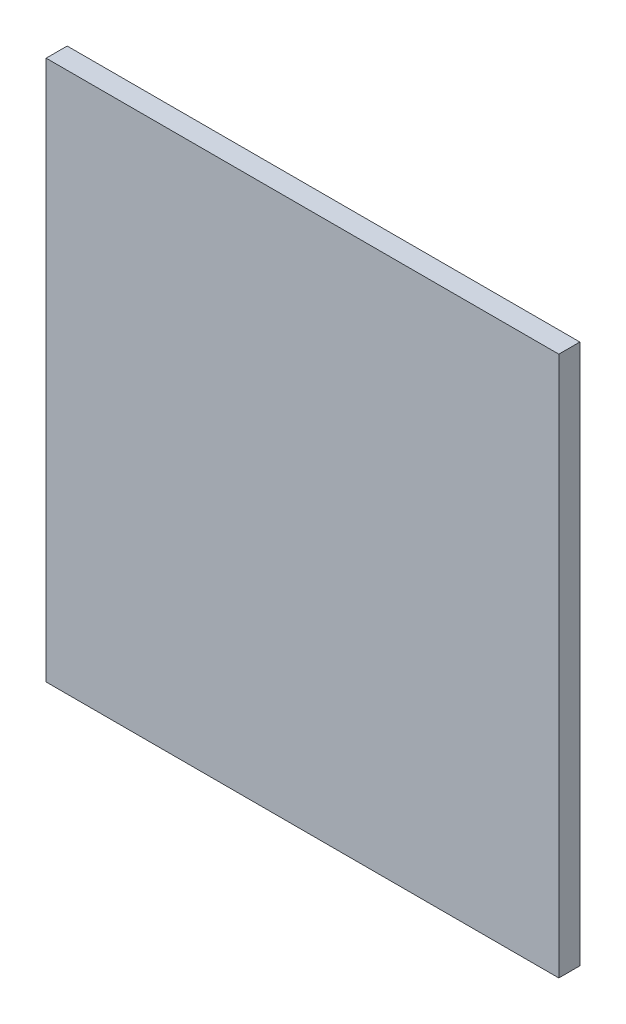
from build123d import *

# Parameters (mm, degrees)
SKETCH1_W           = 1096
SKETCH1_H           = 1155
BOSS_EXTRUDE1_DEPTH = 45


with BuildPart() as part:
    # Sketch1 → Boss-Extrude1 (new body)
    with BuildSketch(Plane.XY):
        with Locations((548, 577.5)):
            Rectangle(SKETCH1_W, SKETCH1_H)
    extrude(amount=BOSS_EXTRUDE1_DEPTH)


solid = part.part
